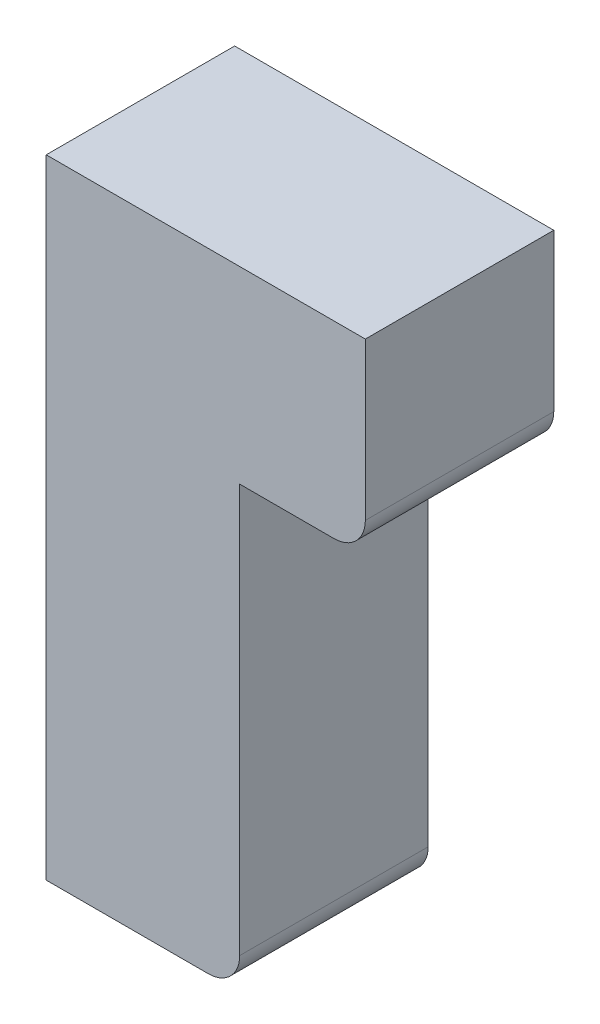
from build123d import *

# Parameters (mm, degrees)
BOSS_EXTRUDE1_DEPTH = 3
FILLET1_R           = 0.5
FILLET3_R           = 0.5


with BuildPart() as part:
    # Sketch1 → Boss-Extrude1 (new body)
    with BuildSketch(Plane.XY):
        Polygon((-6.445210562, 7.139162572), (-1.365210562, 7.139162572), (-1.365210562, 4.139162572), (-3.365210562, 4.139162572), (-3.365210562, -2.860837428), (-6.445210562, -2.860837428), align=None)
    extrude(amount=BOSS_EXTRUDE1_DEPTH)

    # Fillet1
    fillet1_edges = [part.edges().sort_by_distance(p)[0] for p in [
        (-3.365210562, -2.860837428, 1.5),
    ]]
    fillet(fillet1_edges, radius=FILLET1_R)

    # Fillet3
    fillet3_edges = [part.edges().sort_by_distance(p)[0] for p in [
        (-1.365210562, 4.139162572, 1.5),
    ]]
    fillet(fillet3_edges, radius=FILLET3_R)


solid = part.part
